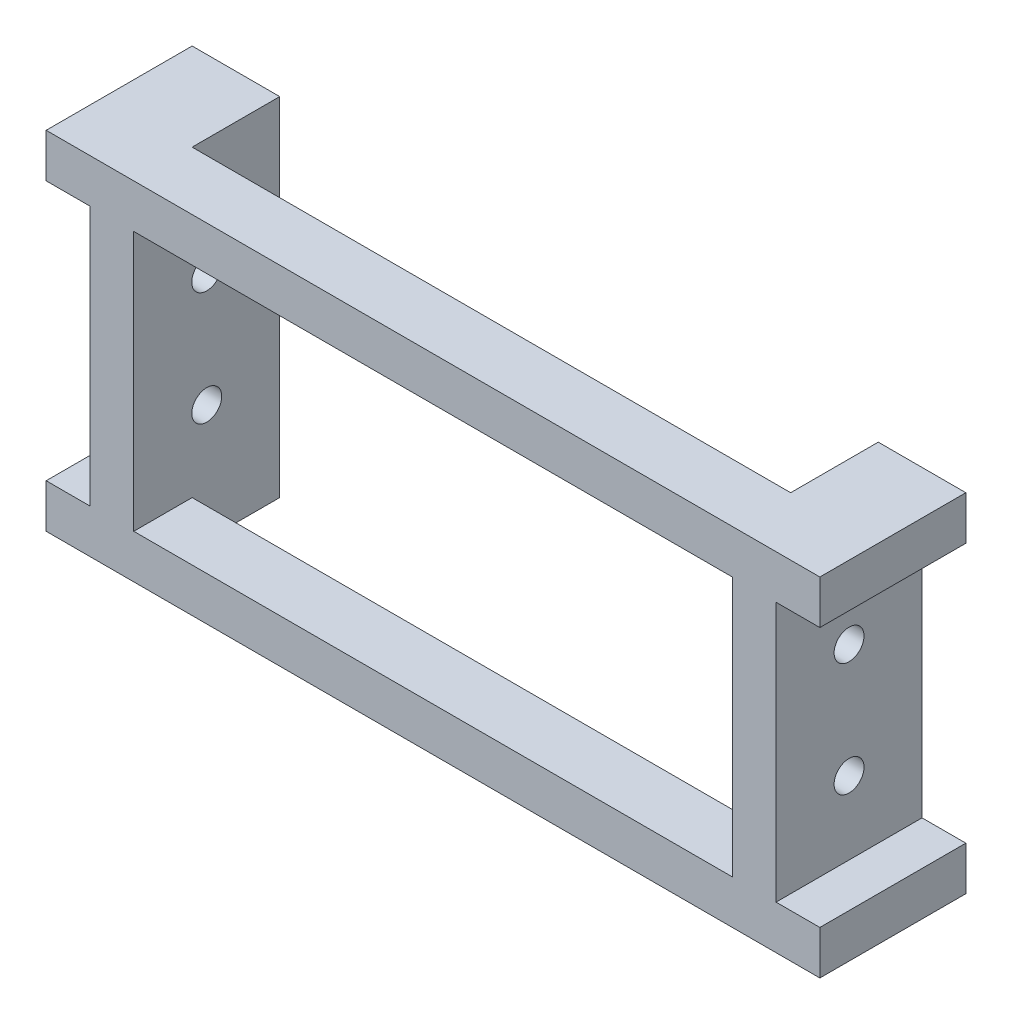
from build123d import *

# Parameters (mm, degrees)
SKETCH1_W                    = 41
SKETCH1_H                    = 17.79
BOSS_EXTRUDE1_DEPTH          = 10
M2_5X0_45_TAPPED_HOLE2_D     = 2.05
M2_5X0_45_TAPPED_HOLE2_DEPTH = 7.25
M2_5X0_45_TAPPED_HOLE2_TIP   = 0.615882135
M2_5X0_45_TAPPED_HOLE1_D     = 2.05
M2_5X0_45_TAPPED_HOLE1_DEPTH = 7.25
M2_5X0_45_TAPPED_HOLE1_TIP   = 0.615882135
SKETCH10_W                   = 41
SKETCH10_H                   = 3
CUT_EXTRUDE1_DEPTH           = 6


with BuildPart() as part:
    # Sketch1 → Boss-Extrude1 (new body)
    with BuildSketch(Plane.XY):
        Polygon((12.281684518, 9.551958914), (15.281684518, 9.551958914), (15.281684518, 12.551958914), (-37.718315482, 12.551958914), (-37.718315482, 9.551958914), (-34.718315482, 9.551958914), (-34.718315482, -8.238041086), (-37.718315482, -8.238041086), (-37.718315482, -11.238041086), (15.281684518, -11.238041086), (15.281684518, -8.238041086), (12.281684518, -8.238041086), align=None)
        with Locations((-11.218315482, 0.656958914)):
            Rectangle(SKETCH1_W, SKETCH1_H, mode=Mode.SUBTRACT)
    extrude(amount=BOSS_EXTRUDE1_DEPTH)

    # M2.5x0.45 Tapped Hole2
    with Locations(Plane.ZY.offset(34.718315482)):
        with Locations((5, 4.551958914), (5, -3.238041086)):
            Hole(M2_5X0_45_TAPPED_HOLE2_D / 2, depth=M2_5X0_45_TAPPED_HOLE2_DEPTH)
            with Locations((0, 0, -(M2_5X0_45_TAPPED_HOLE2_DEPTH + M2_5X0_45_TAPPED_HOLE2_TIP / 2))):  # 118° drill point
                Cone(0, M2_5X0_45_TAPPED_HOLE2_D / 2, M2_5X0_45_TAPPED_HOLE2_TIP, mode=Mode.SUBTRACT)

    # M2.5x0.45 Tapped Hole1
    with Locations(Plane(origin=(12.281684518, 2.476678441, 1.606875776), x_dir=(0, 0, -1), z_dir=(1, 0, 0))):
        with Locations((-3.393124224, 2.075280473), (-3.393124224, -5.714719527)):
            Hole(M2_5X0_45_TAPPED_HOLE1_D / 2, depth=M2_5X0_45_TAPPED_HOLE1_DEPTH)
            with Locations((0, 0, -(M2_5X0_45_TAPPED_HOLE1_DEPTH + M2_5X0_45_TAPPED_HOLE1_TIP / 2))):  # 118° drill point
                Cone(0, M2_5X0_45_TAPPED_HOLE1_D / 2, M2_5X0_45_TAPPED_HOLE1_TIP, mode=Mode.SUBTRACT)

    # Sketch10 → Cut-Extrude1 (cut)
    with BuildSketch(Plane(origin=(0, 0, 0), x_dir=(-1, 0, 0), z_dir=(0, 0, -1))):
        with Locations((11.218315482, -9.738041086)):
            Rectangle(SKETCH10_W, SKETCH10_H)
    cut_extrude1 = extrude(amount=-CUT_EXTRUDE1_DEPTH, mode=Mode.SUBTRACT)

    # Mirror3: Cut-Extrude1 across plane
    add(cut_extrude1.mirror(Plane.ZX.offset(0.656958914)), mode=Mode.SUBTRACT)


solid = part.part
